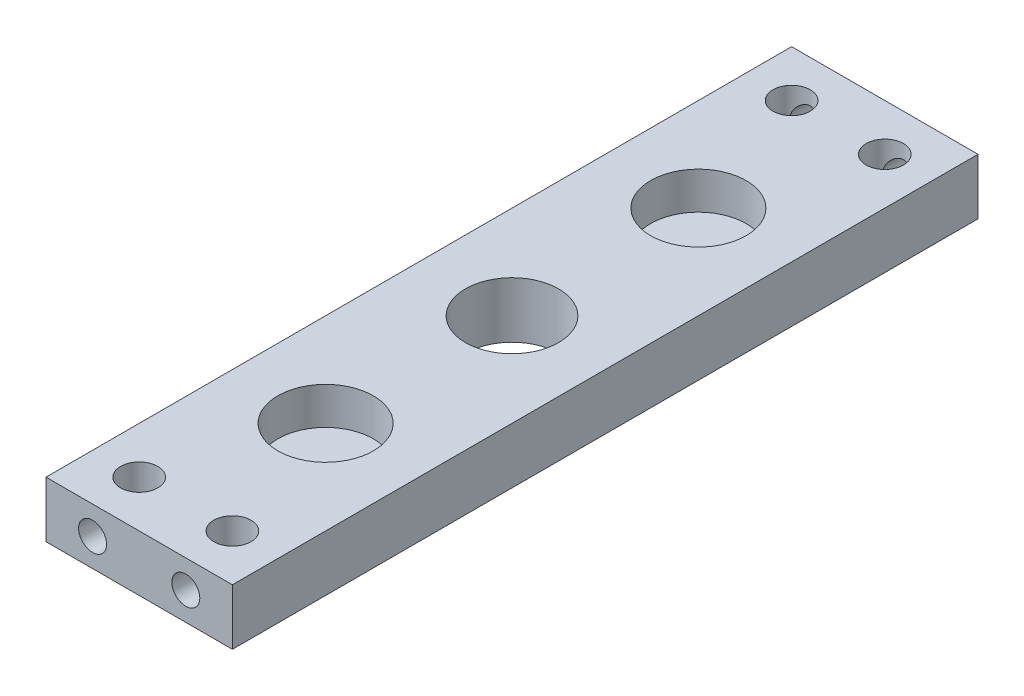
from build123d import *

# Parameters (mm, degrees)
SKETCH1_W           = 40
SKETCH1_H           = 160
SKETCH1_R           = 10
BOSS_EXTRUDE1_DEPTH = 12
CUT_EXTRUDE3_REACH  = 85.331
SKETCH4_R           = 4
CUT_EXTRUDE4_REACH  = 163.691
SKETCH5_R           = 3
SKETCH6_R           = 10.25
CUT_EXTRUDE5_DEPTH  = 8


with BuildPart() as part:
    # Sketch1 → Boss-Extrude1 (new body)
    with BuildSketch(Plane(origin=(0, 0, 0), x_dir=(1, 0, 0), z_dir=(0, 1, 0))):
        Rectangle(SKETCH1_W, SKETCH1_H)
        with Locations(Location((0, 0, 0), (0, 0, 270))):
            Circle(SKETCH1_R, mode=Mode.SUBTRACT)
    extrude(amount=BOSS_EXTRUDE1_DEPTH)

    # Sketch4 → Cut-Extrude3 (cut, up to next)
    with BuildSketch(Plane(origin=(0, 12, 0), x_dir=(1, 0, 0), z_dir=(0, 1, 0)), mode=Mode.PRIVATE) as cut_extrude3_sk1:
        with Locations(Location((-10, 70, 0), (0, 0, 270))):
            Circle(SKETCH4_R)
    cut_extrude3_tool1 = extrude(cut_extrude3_sk1.sketch, amount=-CUT_EXTRUDE3_REACH, mode=Mode.PRIVATE) & part.part
    # Sketch4 → Cut-Extrude3 (cut, up to next)
    with BuildSketch(Plane(origin=(0, 12, 0), x_dir=(1, 0, 0), z_dir=(0, 1, 0)), mode=Mode.PRIVATE) as cut_extrude3_sk2:
        with Locations(Location((10, 70, 0), (0, 0, 270))):
            Circle(SKETCH4_R)
    cut_extrude3_tool2 = extrude(cut_extrude3_sk2.sketch, amount=-CUT_EXTRUDE3_REACH, mode=Mode.PRIVATE) & part.part
    cut_extrude3_1 = cut_extrude3_tool1.solids().sort_by_distance((-10, 12, -70))[0]
    add(cut_extrude3_1, mode=Mode.SUBTRACT)
    cut_extrude3_2 = cut_extrude3_tool2.solids().sort_by_distance((10, 12, -70))[0]
    add(cut_extrude3_2, mode=Mode.SUBTRACT)
    cut_extrude3 = cut_extrude3_1 + cut_extrude3_2  # Cut-Extrude3 as one shape, for the pattern or mirror that repeats it

    # Sketch5 → Cut-Extrude4 (cut, up to next)
    with BuildSketch(Plane(origin=(0, 0, -80), x_dir=(-1, 0, 0), z_dir=(0, 0, -1)), mode=Mode.PRIVATE) as cut_extrude4_sk1:
        with Locations((10, 6)):
            Circle(SKETCH5_R)
    cut_extrude4_tool1 = extrude(cut_extrude4_sk1.sketch, amount=-CUT_EXTRUDE4_REACH, mode=Mode.PRIVATE) & part.part
    # Sketch5 → Cut-Extrude4 (cut, up to next)
    with BuildSketch(Plane(origin=(0, 0, -80), x_dir=(-1, 0, 0), z_dir=(0, 0, -1)), mode=Mode.PRIVATE) as cut_extrude4_sk2:
        with Locations((-10, 6)):
            Circle(SKETCH5_R)
    cut_extrude4_tool2 = extrude(cut_extrude4_sk2.sketch, amount=-CUT_EXTRUDE4_REACH, mode=Mode.PRIVATE) & part.part
    cut_extrude4_1 = cut_extrude4_tool1.solids().sort_by_distance((-10, 6, -80))[0]
    add(cut_extrude4_1, mode=Mode.SUBTRACT)
    cut_extrude4_2 = cut_extrude4_tool2.solids().sort_by_distance((10, 6, -80))[0]
    add(cut_extrude4_2, mode=Mode.SUBTRACT)
    cut_extrude4 = cut_extrude4_1 + cut_extrude4_2  # Cut-Extrude4 as one shape, for the pattern or mirror that repeats it

    # Mirror1: Cut-Extrude3, Cut-Extrude4 across plane
    add(cut_extrude3.mirror(Plane.XY), mode=Mode.SUBTRACT)
    add(cut_extrude4.mirror(Plane.XY), mode=Mode.SUBTRACT)

    # Sketch6 → Cut-Extrude5 (cut)
    with BuildSketch(Plane(origin=(0, 12, 0), x_dir=(1, 0, 0), z_dir=(0, 1, 0))):
        with Locations(Location((0, 40, 0), (0, 0, 270))):
            Circle(SKETCH6_R)
        with Locations(Location((0, -40, 0), (0, 0, 270))):
            Circle(SKETCH6_R)
    extrude(amount=-CUT_EXTRUDE5_DEPTH, mode=Mode.SUBTRACT)


solid = part.part
